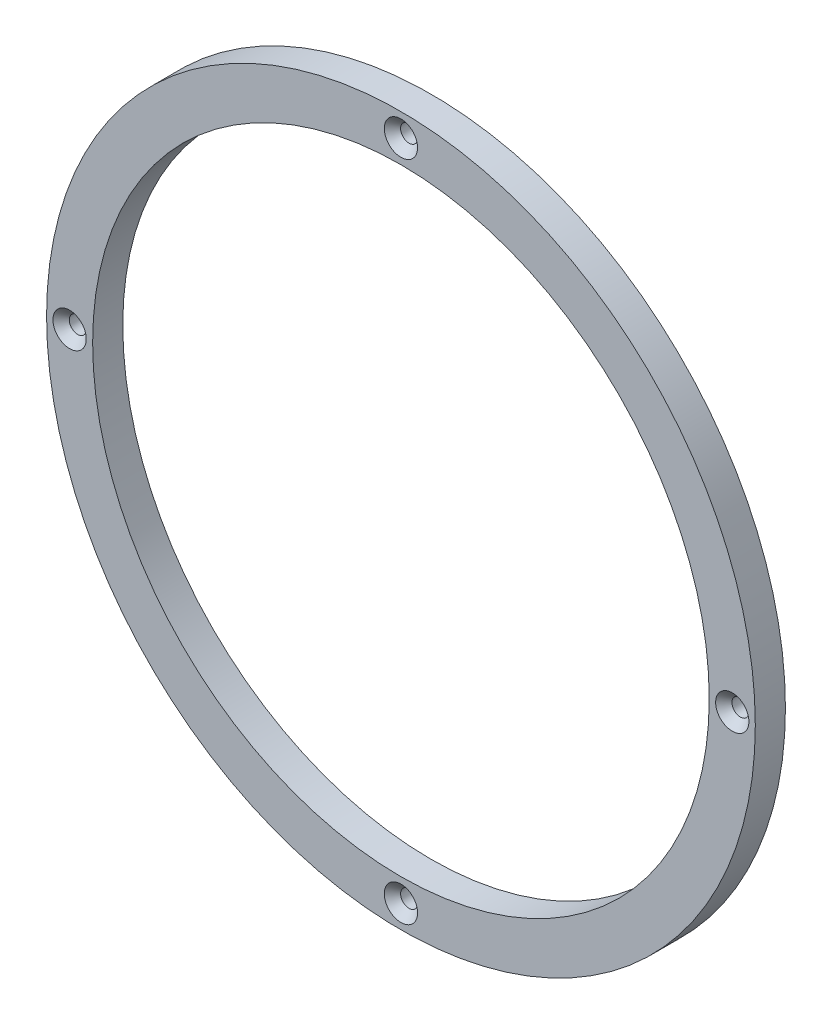
from build123d import *

# Parameters (mm, degrees)
SKETCH_1_R                   = 100
SKETCH_1_R_2                 = 87
SKETCH_1_R_3                 = 2.25
EXTRUDE_1_DEPTH              = 8.5
HOLE_WIZARD_M4_1_D           = 4.8
HOLE_WIZARD_M4_1_CSINK_D     = 9.4
HOLE_WIZARD_M4_1_CSINK_ANGLE = 90


with BuildPart() as part:
    # ｽｹｯﾁ1 → ﾎﾞｽ - 押し出し1 (new body)
    with BuildSketch(Plane.XY):
        Circle(SKETCH_1_R)
        Circle(SKETCH_1_R_2, mode=Mode.SUBTRACT)
        with Locations((0, 93.5)):
            Circle(SKETCH_1_R_3, mode=Mode.SUBTRACT)
        with Locations((93.5, 0)):
            Circle(SKETCH_1_R_3, mode=Mode.SUBTRACT)
        with Locations((0, -93.5)):
            Circle(SKETCH_1_R_3, mode=Mode.SUBTRACT)
        with Locations((-93.5, 0)):
            Circle(SKETCH_1_R_3, mode=Mode.SUBTRACT)
    extrude(amount=EXTRUDE_1_DEPTH)

    # M4 丸皿ねじ用皿穴1 (through all)
    with Locations(Plane.XY.offset(8.5)):
        with Locations((-93.5, 0), (0, 93.5), (93.5, 0), (0, -93.5)):
            CounterSinkHole(HOLE_WIZARD_M4_1_D / 2, HOLE_WIZARD_M4_1_CSINK_D / 2, counter_sink_angle=HOLE_WIZARD_M4_1_CSINK_ANGLE)


solid = part.part
